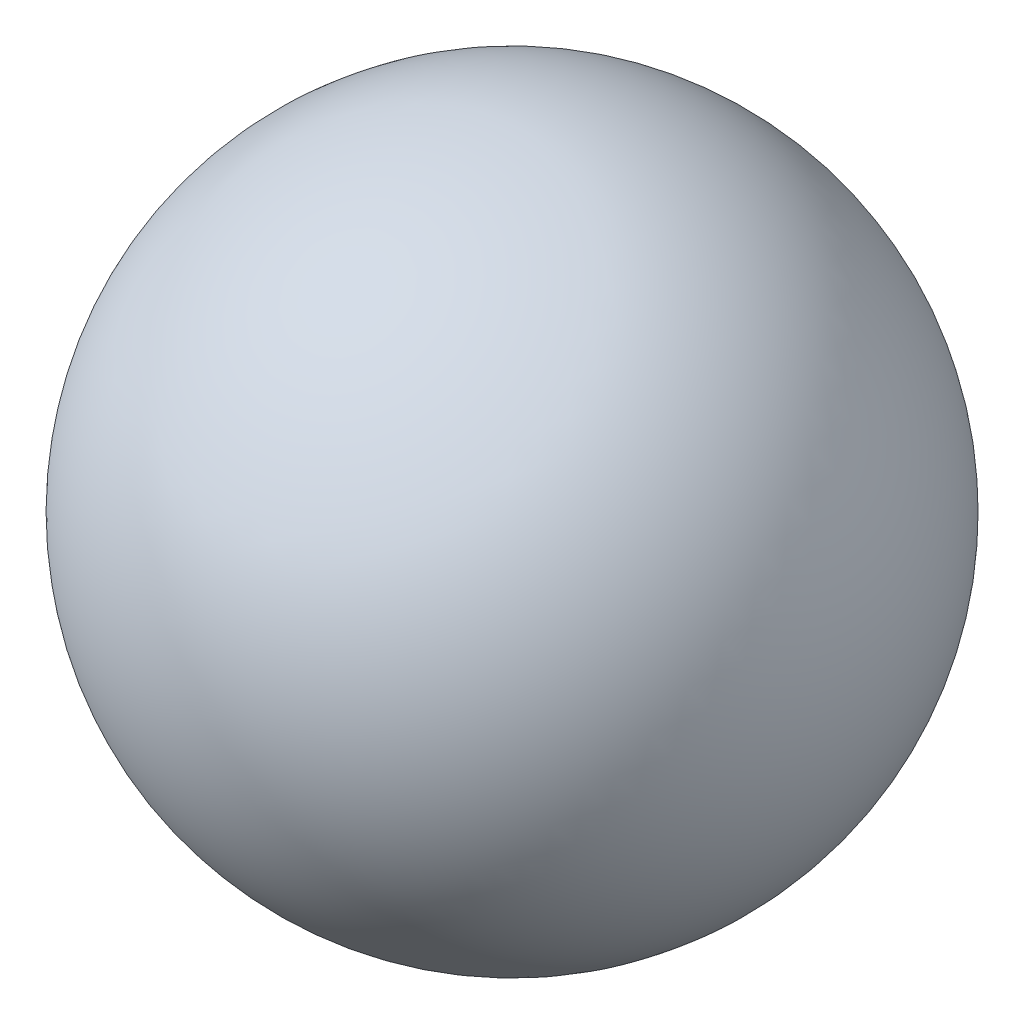
from build123d import *


with BuildPart() as part:
    # Sketch1 → Revolve1 (revolve)
    with BuildSketch(Plane.XY):
        with BuildLine():
            Line((-333.850942893, 56.096476788), (-337.035742316, 62.330019331))
            ThreePointArc((-337.035742316, 62.330019331), (-338.560113876, 57.620848348), (-333.850942893, 56.096476788))
        make_face()
    revolve(axis=Axis((-333.850942893, 56.096476788, 0), (-0.4549713461189865, 0.8905060775821114, 0)))


solid = part.part
